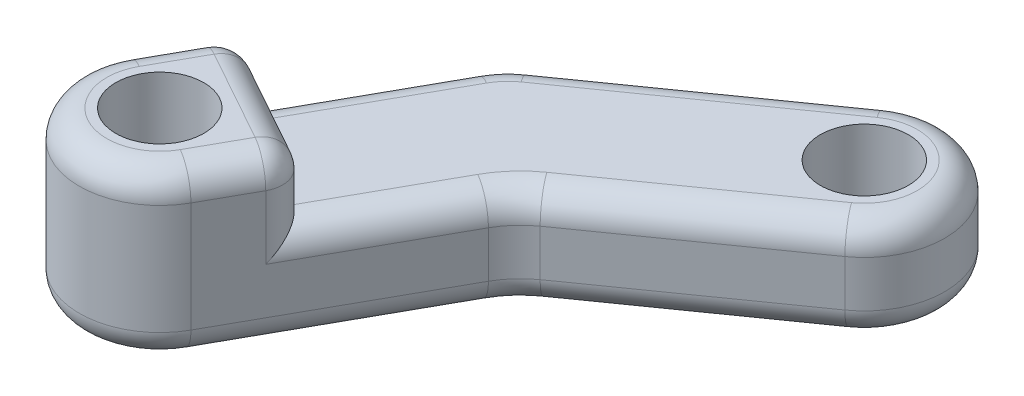
from build123d import *

# Parameters (mm, degrees)
SKETCH1_R           = 1.6000000000000019
SKETCH1_R_2         = 1.6
BOSS_EXTRUDE1_DEPTH = 6
FILLET2_R           = 1
CUT_EXTRUDE1_START  = -2.3175
SKETCH3_R           = 1.6
CUT_EXTRUDE1_DEPTH  = 2.3175
FILLET3_R           = 1
FILLET4_R           = 1


with BuildPart() as part:
    # Sketch1 → Boss-Extrude1 (new body)
    with BuildSketch(Plane(origin=(0, 0, 0), x_dir=(1, 0, 0), z_dir=(0, 1, 0))):
        with BuildLine():
            Line((-14.676643190871216, 12.058848545686113), (-10.160612201428068, 3.951430072051938))
            ThreePointArc((-10.160612201428068, 3.951430072051938), (-9.770701137956143, 3.4055643719184734), (-9.26924383935776, 2.9599854477283642))
            Line((-9.26924383935776, 2.9599854477283642), (-1.6862307188325316, -2.390031581980774))
            ThreePointArc((-1.6862307188325316, -2.390031581980774), (2.3900315819807747, -1.6862307188325345), (1.6862307188325354, 2.3900315819807725))
            Line((1.6862307188325354, 2.3900315819807725), (-4.8073944342993835, 6.9714564854625545))
            ThreePointArc((-4.8073944342993835, 6.9714564854625545), (-5.308851732897766, 7.417035409652663), (-5.6987627963696905, 7.962901109786128))
            Line((-5.6987627963696905, 7.962901109786128), (-9.566013447169048, 14.90559469221669))
            ThreePointArc((-9.566013447169048, 14.90559469221669), (-13.54470139228542, 16.037536490802488), (-14.676643190871216, 12.058848545686113))
        make_face()
        with Locations(Location((-12.121328319020131, 13.482221618951401, 0), (0, 0, 270))):
            Circle(SKETCH1_R, mode=Mode.SUBTRACT)
        with Locations(Location((1.73e-15, -8.7e-16, 0), (0, 0, 270))):
            Circle(SKETCH1_R_2, mode=Mode.SUBTRACT)
    extrude(amount=BOSS_EXTRUDE1_DEPTH)

    # Fillet2
    fillet2_edges = [part.edges().sort_by_distance(p)[0] for p in [
        (-12.418627696149642, 0, -8.005139308869026),
        (-13.544701392285422, 0, -16.037536490802488),
        (-7.632388121769369, 0, -11.43424790100141),
        (-5.308851732897767, 0, -7.417035409652664),
        (-13.544701392285422, 6, -16.037536490802488),
        (-12.418627696149642, 6, -8.005139308869026),
        (-9.770701137956143, 6, -3.405564371918474),
        (-5.4777372790951455, 6, -0.28497693287379544),
        (2.390031581980775, 6, 1.686230718832534),
        (-1.5605818577334243, 6, -4.6807440337216635),
        (-5.308851732897767, 6, -7.417035409652664),
        (-1.5605818577334243, 0, -4.6807440337216635),
        (-7.632388121769369, 6, -11.43424790100141),
        (2.390031581980775, 0, 1.686230718832534),
        (-5.4777372790951455, 0, -0.28497693287379544),
        (-9.770701137956143, 0, -3.405564371918474),
    ]]
    fillet(fillet2_edges, radius=FILLET2_R)

    # Sketch3 → Cut-Extrude1 (cut)
    # profile 1 of 2: a face of its own
    with BuildSketch(Plane(origin=(0, 6, 0), x_dir=(1, 0, 0), z_dir=(0, 1, 0)).offset(CUT_EXTRUDE1_START)):
        with BuildLine():
            ThreePointArc((-5.383883568942986, 6.154351671110155), (-6.052493300407496, 6.748456903363634), (-6.572374718370062, 7.476277836874918))
            Line((-6.572374718370061, 7.476277836874918), (-8.97975555043579, 11.79813565330437))
            Line((-8.979755550435788, 11.79813565330437), (-12.343161450137215, 9.924636052596211))
            Line((-12.343161450137217, 9.92463605259621), (-9.287000279427696, 4.438053344963148))
            ThreePointArc((-9.287000279427696, 4.438053344963148), (-9.027059570446415, 4.074142878207507), (-8.692754704714162, 3.7770902620807663))
            Line((-8.692754704714162, 3.7770902620807667), (-1.1097415841889307, -1.5729267676283727))
            ThreePointArc((-1.1097415841889307, -1.5729267676283722), (1.5729267676283736, -1.1097415841889322), (1.1097415841889327, 1.5729267676283718))
            Line((1.1097415841889327, 1.5729267676283716), (-5.383883568942986, 6.154351671110155))
        make_face()
        with Locations(Location((1.73e-15, -8.7e-16, 0), (0, 0, 270))):
            Circle(SKETCH3_R, mode=Mode.SUBTRACT)
    # profile 2 of 2: a face of its own
    with BuildSketch(Plane(origin=(0, 6, 0), x_dir=(1, 0, 0), z_dir=(0, 1, 0)).offset(CUT_EXTRUDE1_START)):
        with BuildLine():
            Line((-8.97975555043579, 11.79813565330437), (-6.572374718370061, 7.476277836874918))
            ThreePointArc((-6.572374718370062, 7.476277836874918), (-6.052493300407496, 6.748456903363634), (-5.383883568942986, 6.154351671110155))
            Line((-5.383883568942986, 6.154351671110155), (1.1097415841889327, 1.5729267676283716))
            ThreePointArc((1.1097415841889327, 1.5729267676283718), (1.5729267676283736, -1.1097415841889322), (-1.1097415841889307, -1.5729267676283722))
            Line((-1.1097415841889307, -1.5729267676283727), (-8.692754704714162, 3.7770902620807667))
            ThreePointArc((-8.692754704714162, 3.7770902620807663), (-9.027059570446415, 4.074142878207507), (-9.287000279427696, 4.438053344963148))
            Line((-9.287000279427696, 4.438053344963148), (-12.343161450137217, 9.92463605259621))
            Line((-12.343161450137215, 9.924636052596211), (-13.216773372137586, 9.438012779685))
            Line((-13.216773372137586, 9.438012779685), (-10.160612201428068, 3.951430072051938))
            ThreePointArc((-10.160612201428068, 3.951430072051938), (-9.770701137956145, 3.4055643719184743), (-9.269243839357761, 2.959985447728366))
            Line((-9.269243839357761, 2.9599854477283656), (-1.6862307188325316, -2.390031581980774))
            ThreePointArc((-1.6862307188325316, -2.390031581980774), (2.3900315819807743, -1.686230718832534), (1.686230718832535, 2.390031581980772))
            Line((1.686230718832534, 2.3900315819807725), (-4.8073944342993835, 6.9714564854625545))
            ThreePointArc((-4.807394434299383, 6.971456485462554), (-5.308851732897767, 7.417035409652663), (-5.6987627963696905, 7.962901109786128))
            Line((-5.6987627963696905, 7.962901109786128), (-8.10614362843542, 12.284758926215579))
            Line((-8.10614362843542, 12.284758926215579), (-8.979755550435788, 11.79813565330437))
        make_face()
    extrude(amount=CUT_EXTRUDE1_DEPTH, mode=Mode.SUBTRACT)

    # Fillet3
    fillet3_edges = [part.edges().sort_by_distance(p)[0] for p in [
        (-6.9024532124025555, 3.6825, -10.123830018000854),
        (-5.308851732897768, 3.6825, -7.417035409652662),
        (-1.5605818577334247, 3.6825, -4.6807440337216635),
        (-5.477737279095146, 3.6825, -0.2849769328737959),
        (-11.688692786782827, 3.6825, -6.694721425868469),
        (-9.770701137956145, 3.6825, -3.405564371918474),
        (2.390031581980774, 3.6825, 1.6862307188325336),
    ]]
    fillet(fillet3_edges, radius=FILLET3_R)

    # Fillet4
    fillet4_edges = [part.edges().sort_by_distance(p)[0] for p in [
        (-12.96089836430909, 5.707106781186548, -9.580541436437505),
        (-10.661458500286502, 6, -10.86138585295029),
        (-8.362018636263915, 5.707106781186548, -12.142230269463079),
        (-13.216773372137585, 3.84125, -9.438012779685),
        (-8.106143628435422, 3.84125, -12.28475892621558),
    ]]
    fillet(fillet4_edges, radius=FILLET4_R)


with BuildPart() as body_2:
    # Mirror12: mirrored copy
    add(part.part.mirror(Plane.XY.offset(16.56331838768985)))


solid = body_2.part
